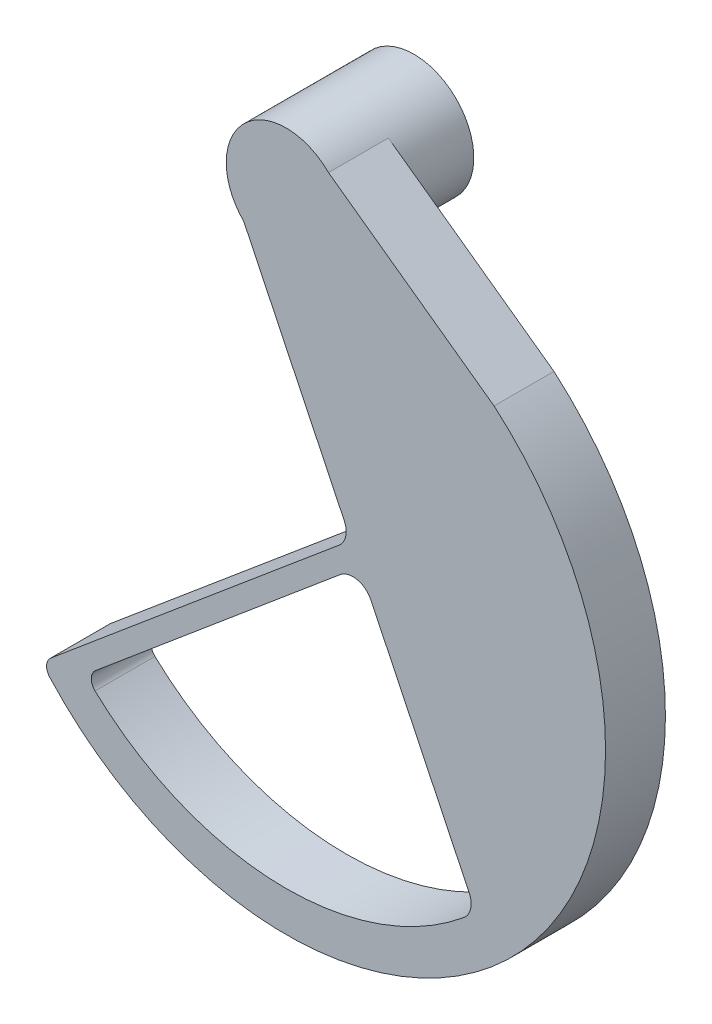
from build123d import *

# Parameters (mm, degrees)
EXTRUDE_1_DEPTH     = 15
EXTRUDE_START       = 17
SKETCH_9_R          = 15
EXTRUDE_3_DEPTH     = 17
SKETCH_10_R         = 10
CUT_EXTRUDE_4_DEPTH = 2


with BuildPart() as part:
    # ｽｹｯﾁ4 → ﾎﾞｽ - 押し出し1 (new body)
    with BuildSketch(Plane.XY):
        with BuildLine():
            Line((-53.623111018, -124.995132678), (-58.940636287, -129.45706617))
            ThreePointArc((-58.940636287, -129.45706617), (-60.005384698, -131.552012131), (-59.233530865, -133.771635843))
            ThreePointArc((-59.233530865, -133.771635843), (57.362306223, -135.763481103), (52.076178918, -19.270504783))
            Line((52.076178918, -19.270504783), (10.606601718, 10.606601718))
            ThreePointArc((10.606601718, 10.606601718), (-10.606601718, 10.606601718), (-10.606601718, -10.606601718))
            Line((-10.606601718, -10.606601718), (14.536280154, -62.889638219))
            ThreePointArc((14.536280154, -62.889638219), (14.918089499, -66.109676181), (13.244185189, -68.886809092))
            Line((13.244185189, -68.886809092), (-53.623111018, -124.995132678))
        make_face()
        with BuildLine():
            Line((21.232400696, -76.813798404), (45.844843506, -127.993820346))
            ThreePointArc((45.844843506, -127.993820346), (46.221944165, -131.235480845), (44.518718993, -134.019289696))
            ThreePointArc((44.518718993, -134.019289696), (-2.231208213, -149.964431749), (-47.870174388, -131.072951785))
            ThreePointArc((-47.870174388, -131.072951785), (-48.817477846, -128.802229421), (-47.747678417, -126.586582094))
            Line((-47.747678417, -126.586582094), (13.511229465, -75.151532228))
            ThreePointArc((13.511229465, -75.151532228), (17.77869109, -74.092739753), (21.232400696, -76.813798404))
        make_face(mode=Mode.SUBTRACT)
    extrude(amount=EXTRUDE_1_DEPTH)

    # ｽｹｯﾁ9 → ﾎﾞｽ - 押し出し3 (add)
    with BuildSketch(Plane(origin=(0, 0, 0), x_dir=(-1, 0, 0), z_dir=(0, 0, -1)).offset(EXTRUDE_START)):
        Circle(SKETCH_9_R)
    extrude(amount=-EXTRUDE_3_DEPTH)

    # ｽｹｯﾁ10 → ｶｯﾄ - 押し出し4 (cut)
    with BuildSketch(Plane(origin=(0, 0, -17), x_dir=(-1, 0, 0), z_dir=(0, 0, -1))):
        Circle(SKETCH_10_R)
    extrude(amount=-CUT_EXTRUDE_4_DEPTH, mode=Mode.SUBTRACT)


solid = part.part
